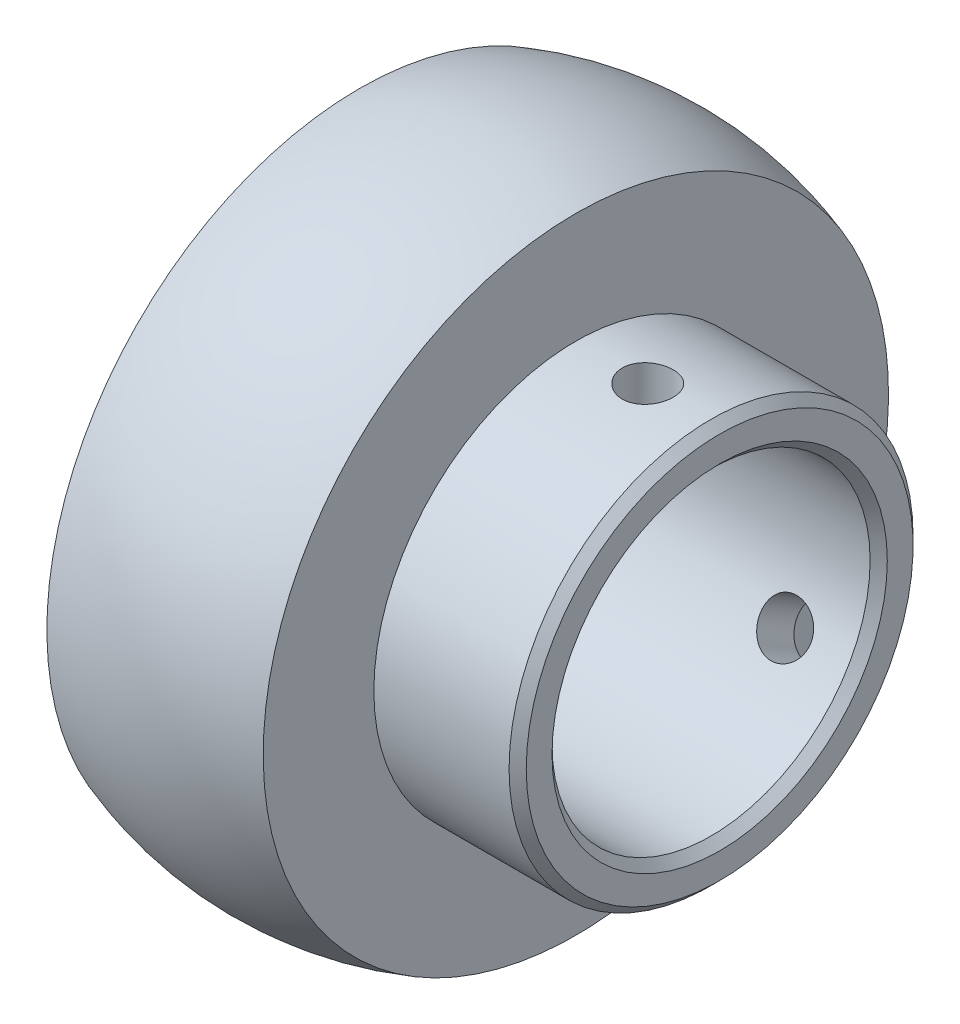
from build123d import *

# Parameters (mm, degrees)
SKETCH_2_R               = 2
CUT_EXTRUDE_1_DEPTH      = 42.761704946
PATTERN_CIRCULAR_1_COUNT = 2
PATTERN_CIRCULAR_1_ANGLE = 120
CHAMFER_1_SIZE           = 0.675


with BuildPart() as part:
    # Эскиз1 → Повернуть1 (revolve)
    with BuildSketch(Plane.XY, mode=Mode.PRIVATE) as revolve_1_sk:
        with BuildLine():
            Line((-8.5, 24.571324751), (-8.5, 15.875))
            Line((-8.5, 15.875), (-14.3, 15.875))
            Line((-14.3, 15.875), (-14.3, 12.5))
            Line((-14.3, 12.5), (19.8, 12.5))
            Line((19.8, 12.5), (19.8, 15.875))
            Line((19.8, 15.875), (8.5, 15.875))
            Line((8.5, 15.875), (8.5, 24.571324751))
            ThreePointArc((8.5, 24.571324751), (0, 26), (-8.5, 24.571324751))
        make_face()
    revolve(revolve_1_sk.sketch.rotate(Axis((-1000, 0, 0), (1, 0, 0)), 90), axis=Axis((-1000, 0, 0), (1, 0, 0)))

    # Эскиз2 → Вырез-Вытянуть1 (cut, through all)
    with BuildSketch(Plane(origin=(0, 0, 0), x_dir=(1, 0, 0), z_dir=(0, 1, 0))):
        with Locations(Location((14.15, 0, 0), (0, 0, 90))):
            Circle(SKETCH_2_R)
    cut_extrude_1 = extrude(amount=CUT_EXTRUDE_1_DEPTH, mode=Mode.SUBTRACT)

    # Круговой массив1: Вырез-Вытянуть1 ×2 about axis
    pattern_circular_1_axis = Axis((-1000, 0, 0), (-1, 0, 0))
    for i in range(1, PATTERN_CIRCULAR_1_COUNT):
        add(cut_extrude_1.rotate(pattern_circular_1_axis, i * PATTERN_CIRCULAR_1_ANGLE / (PATTERN_CIRCULAR_1_COUNT - 1)), mode=Mode.SUBTRACT)

    # Фаска1
    chamfer_1_edges = [part.edges().sort_by_distance(p)[0] for p in [
        (-14.3, 0, -15.875),
        (-14.3, 0, -12.5),
        (19.8, 0, -12.5),
        (19.8, 0, -15.875),
    ]]
    chamfer(chamfer_1_edges, length=CHAMFER_1_SIZE)


solid = part.part
